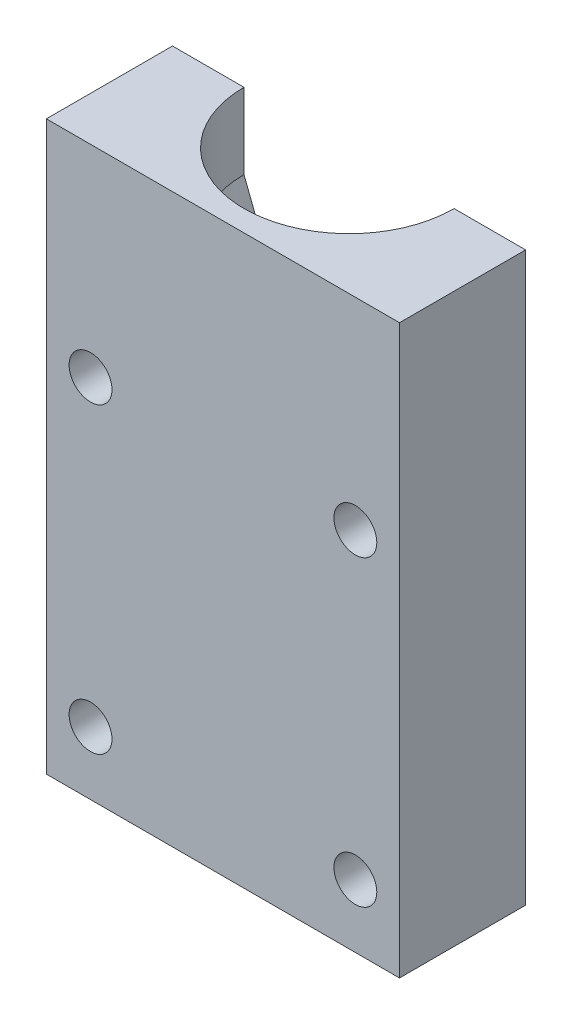
from build123d import *

# Parameters (mm, degrees)
SKETCH4_W           = 28
SKETCH4_H           = 45
BOSS_EXTRUDE2_DEPTH = 10
SKETCH6_R           = 1.7
CUT_EXTRUDE1_DEPTH  = 29.324018077


with BuildPart() as part:
    # Sketch4 → Boss-Extrude2 (new body)
    with BuildSketch(Plane.XY):
        Rectangle(SKETCH4_W, SKETCH4_H)
    extrude(amount=BOSS_EXTRUDE2_DEPTH)

    # Sketch5 → Cut-Revolve1 (revolve, cut)
    with BuildSketch(Plane.XY):
        Polygon((0, 22.5), (8.33, 22.5), (8.33, 16.5), (6, 10.5), (4.75, -18.71), (4.75, -22.5), (0, -22.5), align=None)
    revolve(axis=Axis((0, 0, 0), (0, 1, 0)), mode=Mode.SUBTRACT)

    # Sketch6 → Cut-Extrude1 (cut, through all)
    with BuildSketch(Plane.XY.offset(10)):
        with Locations((-10.5, 6.5)):
            Circle(SKETCH6_R)
        with Locations((-10.5, -17.5)):
            Circle(SKETCH6_R)
        with Locations((10.5, 6.5)):
            Circle(SKETCH6_R)
        with Locations((10.5, -17.5)):
            Circle(SKETCH6_R)
    extrude(amount=-CUT_EXTRUDE1_DEPTH, mode=Mode.SUBTRACT)


solid = part.part
